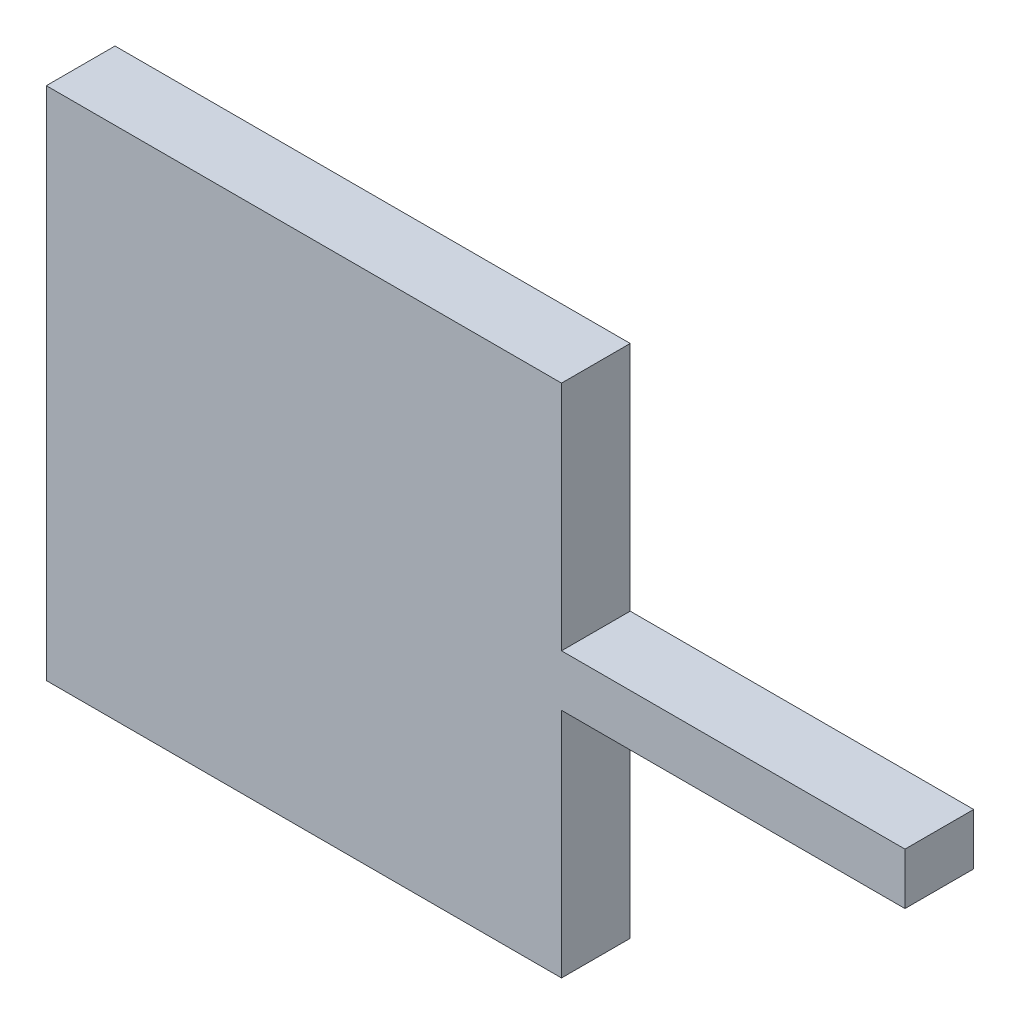
from build123d import *

# Parameters (mm, degrees)
SKETCH1_W           = 2
SKETCH1_H           = 0.4
BOSS_EXTRUDE1_DEPTH = 0.3
SKETCH3_W           = 0.2
SKETCH3_H           = 1.35
SKETCH3_W_2         = 0.4
SKETCH3_H_2         = 0.3
BOSS_EXTRUDE4_DEPTH = 3


with BuildPart() as part:
    # Sketch1 → Boss-Extrude1 (new body)
    with BuildSketch(Plane(origin=(0, 0, 0), x_dir=(1, 0, 0), z_dir=(0, 1, 0))):
        with Locations((1, -0.2)):
            Rectangle(SKETCH1_W, SKETCH1_H)
    extrude(amount=BOSS_EXTRUDE1_DEPTH)

    # Sketch3 → Boss-Extrude4 (add)
    with BuildSketch(Plane.ZY):
        with Locations((0.3, -0.675)):
            Rectangle(SKETCH3_W, SKETCH3_H)
        with Locations((0.1, -0.675)):
            Rectangle(SKETCH3_W, SKETCH3_H)
        with Locations((0.2, 0.15)):
            Rectangle(SKETCH3_W_2, SKETCH3_H_2)
        with Locations((0.1, 0.975)):
            Rectangle(SKETCH3_W, SKETCH3_H)
        with Locations((0.3, 0.975)):
            Rectangle(SKETCH3_W, SKETCH3_H)
    extrude(amount=BOSS_EXTRUDE4_DEPTH)


solid = part.part
